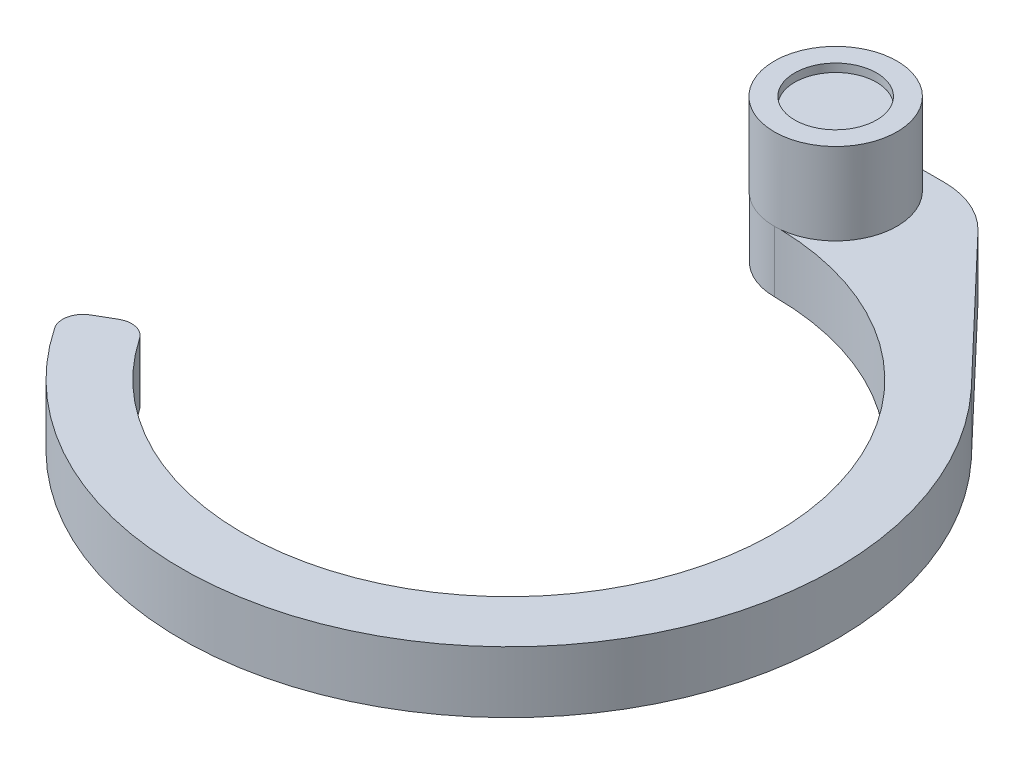
from build123d import *

# Parameters (mm, degrees)
EXTRUDE_4_DEPTH     = 15
SKETCH_10_R         = 15
EXTRUDE_5_DEPTH     = 20
SKETCH_11_R         = 10
CUT_EXTRUDE_1_DEPTH = 2


with BuildPart() as part:
    # ｽｹｯﾁ2 → ﾎﾞｽ - 押し出し4 (new body)
    with BuildSketch(Plane(origin=(0, 0, 0), x_dir=(1, 0, 0), z_dir=(0, 1, 0))):
        with BuildLine():
            ThreePointArc((-53.82643789, -36.437818048), (-56.846261527, -34.367935813), (-60.466933112, -34.910600109))
            Line((-60.466933112, -34.910600109), (-64.807406984, -37.416573868))
            ThreePointArc((-64.807406984, -37.416573868), (-67.177509772, -40.614402853), (-66.461234116, -44.529814279))
            ThreePointArc((-66.461234116, -44.529814279), (49.665387485, -62.716419588), (58.57572973, 54.487465409))
            Line((58.57572973, 54.487465409), (57.289371136, 55.838409315))
            Line((57.289371136, 55.838409315), (25.911523347, 88.791671712))
            ThreePointArc((25.911523347, 88.791671712), (19.306695871, 93.382511176), (11.427401304, 95))
            Line((11.427401304, 95), (0, 95))
            ThreePointArc((0, 95), (-15, 80), (0, 65))
            ThreePointArc((0, 65), (57.41714976, -30.467538684), (-53.82643789, -36.437818048))
        make_face()
    extrude(amount=EXTRUDE_4_DEPTH)

    # ｽｹｯﾁ10 → ﾎﾞｽ - 押し出し5 (add)
    with BuildSketch(Plane(origin=(0, 15, 0), x_dir=(1, 0, 0), z_dir=(0, 1, 0))):
        with Locations(Location((0, 79.906692584, 0), (0, 0, 179.821795675))):
            Circle(SKETCH_10_R)
    extrude(amount=EXTRUDE_5_DEPTH)

    # ｽｹｯﾁ11 → ｶｯﾄ - 押し出し1 (cut)
    with BuildSketch(Plane(origin=(0, 35, 0), x_dir=(1, 0, 0), z_dir=(0, 1, 0))):
        with Locations(Location((0, 79.906692584, 0), (0, 0, 270))):
            Circle(SKETCH_11_R)
    extrude(amount=-CUT_EXTRUDE_1_DEPTH, mode=Mode.SUBTRACT)


solid = part.part
